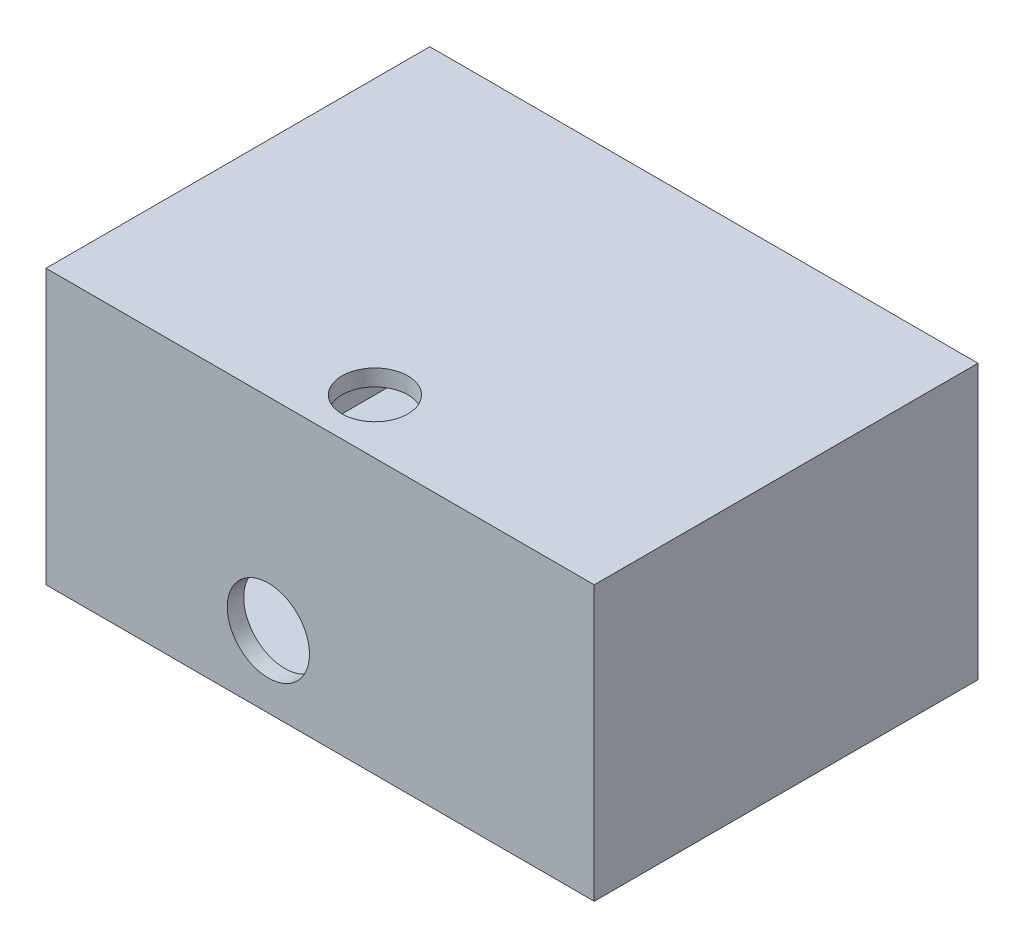
from build123d import *

# Parameters (mm, degrees)
ESQUISSE1_W             = 100
ESQUISSE1_H             = 50
BOSS_EXTRU_1_DEPTH      = 70
COQUE1_T                = -3
BOSS_EXTRU_2_REACH      = 124.205
ESQUISSE2_W             = 64
ESQUISSE2_H             = 3
ESQUISSE3_R             = 6.015
ENL_V_MAT_EXTRU_1_DEPTH = 5
ESQUISSE4_R             = 6
ENL_V_MAT_EXTRU_2_DEPTH = 5
ESQUISSE5_R             = 7.5
ENL_V_MAT_EXTRU_3_DEPTH = 10


with BuildPart() as part:
    # Esquisse1 → Boss.-Extru.1 (new body)
    with BuildSketch(Plane.XY):
        Rectangle(ESQUISSE1_W, ESQUISSE1_H)
    extrude(amount=BOSS_EXTRU_1_DEPTH)

    # Coque1
    coque1_openings = [part.faces().sort_by_distance(p)[0] for p in [
        (0, 25, 35),
    ]]
    offset(amount=COQUE1_T, openings=coque1_openings, kind=Kind.INTERSECTION)

    # Esquisse2 → Boss.-Extru.2 (add, up to next)
    with BuildSketch(Plane(origin=(-47, 0, 0), x_dir=(0, 0, -1), z_dir=(1, 0, 0)), mode=Mode.PRIVATE) as boss_extru_2_sk1:
        with Locations((-35, 23.5)):
            Rectangle(ESQUISSE2_W, ESQUISSE2_H)
    boss_extru_2_tool1 = extrude(boss_extru_2_sk1.sketch, amount=BOSS_EXTRU_2_REACH, mode=Mode.PRIVATE) - part.part
    add(boss_extru_2_tool1.solids().sort_by_distance((-47, 23.5, 35))[0])

    # Esquisse3 → Enlèv. mat.-Extru.1 (cut)
    with BuildSketch(Plane(origin=(0, 25, 0), x_dir=(1, 0, 0), z_dir=(0, 1, 0))):
        with Locations(Location((0, -60, 0), (0, 0, 270))):
            Circle(ESQUISSE3_R)
    extrude(amount=-ENL_V_MAT_EXTRU_1_DEPTH, mode=Mode.SUBTRACT)

    # Esquisse4 → Enlèv. mat.-Extru.2 (cut)
    with BuildSketch(Plane.XY.offset(70)):
        with Locations((-9.44, -11.95)):
            Circle(ESQUISSE4_R)
    extrude(amount=-ENL_V_MAT_EXTRU_2_DEPTH, mode=Mode.SUBTRACT)

    # Esquisse5 → Enlèv. mat.-Extru.3 (cut)
    with BuildSketch(Plane.XY.offset(70)):
        with Locations((-9.44, -11.95)):
            Circle(ESQUISSE5_R)
    extrude(amount=-ENL_V_MAT_EXTRU_3_DEPTH, mode=Mode.SUBTRACT)


solid = part.part
